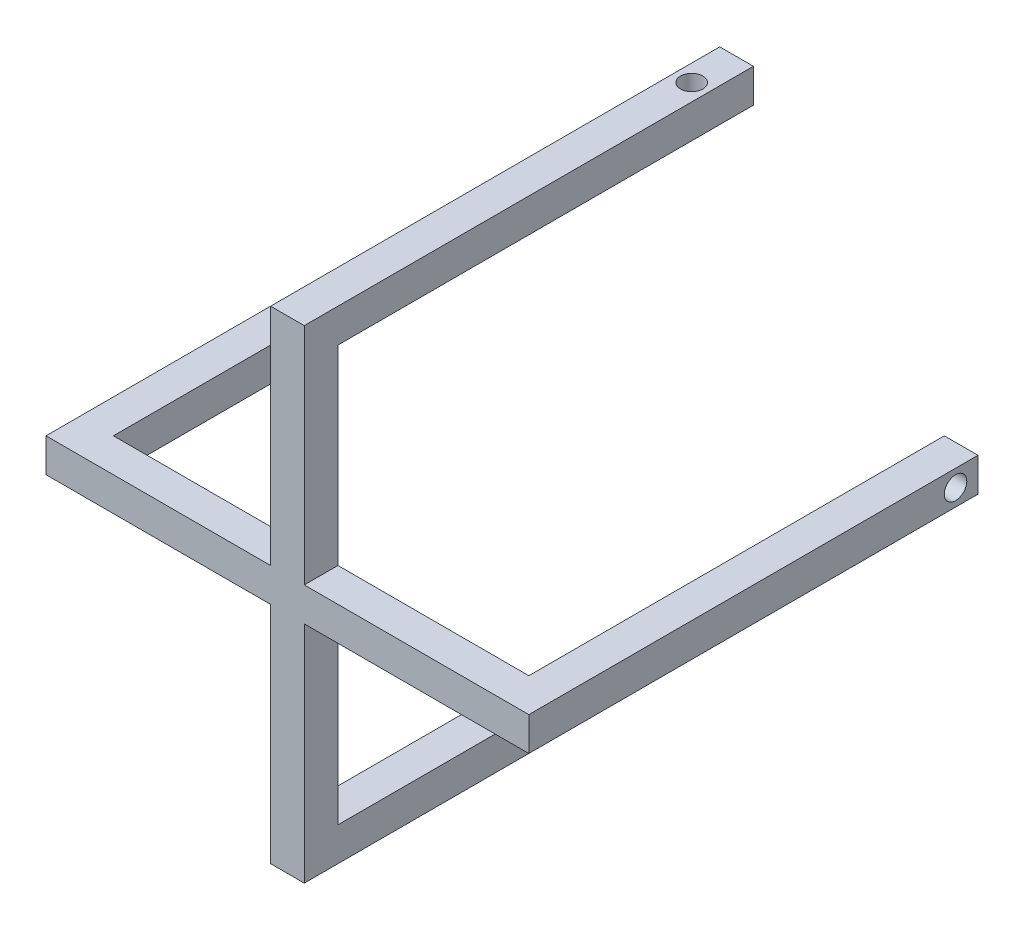
from build123d import *

# Parameters (mm, degrees)
SKETCH1_W           = 15
SKETCH1_H           = 15
BOSS_EXTRUDE2_DEPTH = 200
SKETCH2_W           = 15
SKETCH2_H           = 15
BOSS_EXTRUDE3_DEPTH = 215
SKETCH3_W           = 15
SKETCH3_H           = 15
BOSS_EXTRUDE4_DEPTH = 215
SKETCH4_R           = 5
CUT_EXTRUDE1_DEPTH  = 313.699936041
SKETCH5_R           = 5
CUT_EXTRUDE3_DEPTH  = 313.699936041


with BuildPart() as part:
    # Sketch1 → Boss-Extrude2 (new body)
    with BuildSketch(Plane.XY):
        with BuildLine():
            ThreePointArc((-7.5, 99.718353376), (0, 100), (7.5, 99.718353376))
            Line((7.5, 99.718353376), (7.5, 107.5))
            Line((7.5, 107.5), (-7.5, 107.5))
            Line((-7.5, 107.5), (-7.5, 99.718353376))
        make_face()
        with BuildLine():
            Line((7.5, 92.5), (7.5, 99.718353376))
            ThreePointArc((7.5, 99.718353376), (0, 100), (-7.5, 99.718353376))
            Line((-7.5, 99.718353376), (-7.5, 92.5))
            Line((-7.5, 92.5), (7.5, 92.5))
        make_face()
        with BuildLine():
            ThreePointArc((-99.718353376, 7.5), (-100, 0), (-99.718353376, -7.5))
            Line((-99.718353376, -7.5), (-92.5, -7.5))
            Line((-92.5, -7.5), (-92.5, 7.5))
            Line((-92.5, 7.5), (-99.718353376, 7.5))
        make_face()
        with BuildLine():
            Line((-107.5, -7.5), (-99.718353376, -7.5))
            ThreePointArc((-99.718353376, -7.5), (-100, 0), (-99.718353376, 7.5))
            Line((-99.718353376, 7.5), (-107.5, 7.5))
            Line((-107.5, 7.5), (-107.5, -7.5))
        make_face()
        with BuildLine():
            ThreePointArc((-7.5, -99.718353376), (0, -100), (7.5, -99.718353376))
            Line((7.5, -99.718353376), (7.5, -92.5))
            Line((7.5, -92.5), (-7.5, -92.5))
            Line((-7.5, -92.5), (-7.5, -99.718353376))
        make_face()
        with BuildLine():
            Line((7.5, -107.5), (7.5, -99.718353376))
            ThreePointArc((7.5, -99.718353376), (0, -100), (-7.5, -99.718353376))
            Line((-7.5, -99.718353376), (-7.5, -107.5))
            Line((-7.5, -107.5), (7.5, -107.5))
        make_face()
        with Locations((100, 0)):
            Rectangle(SKETCH1_W, SKETCH1_H)
    extrude(amount=BOSS_EXTRUDE2_DEPTH)

    # Sketch2 → Boss-Extrude3 (add)
    with BuildSketch(Plane.XZ.offset(107.5)):
        with Locations((0, 192.5)):
            Rectangle(SKETCH2_W, SKETCH2_H)
    extrude(amount=-BOSS_EXTRUDE3_DEPTH)

    # Sketch3 → Boss-Extrude4 (add)
    with BuildSketch(Plane(origin=(107.5, 0, 0), x_dir=(0, 0, -1), z_dir=(1, 0, 0))):
        with Locations((-192.5, 0)):
            Rectangle(SKETCH3_W, SKETCH3_H)
    extrude(amount=-BOSS_EXTRUDE4_DEPTH)

    # Sketch4 → Cut-Extrude1 (cut, through all)
    with BuildSketch(Plane(origin=(107.5, 0, 0), x_dir=(0, 0, -1), z_dir=(1, 0, 0))):
        with Locations(Location((-10, 0, 0), (0, 0, 90))):
            Circle(SKETCH4_R)
    extrude(amount=-CUT_EXTRUDE1_DEPTH, mode=Mode.SUBTRACT)

    # Sketch5 → Cut-Extrude3 (cut, through all)
    with BuildSketch(Plane.XZ.offset(107.5)):
        with Locations((0, 20)):
            Circle(SKETCH5_R)
    extrude(amount=-CUT_EXTRUDE3_DEPTH, mode=Mode.SUBTRACT)


solid = part.part
